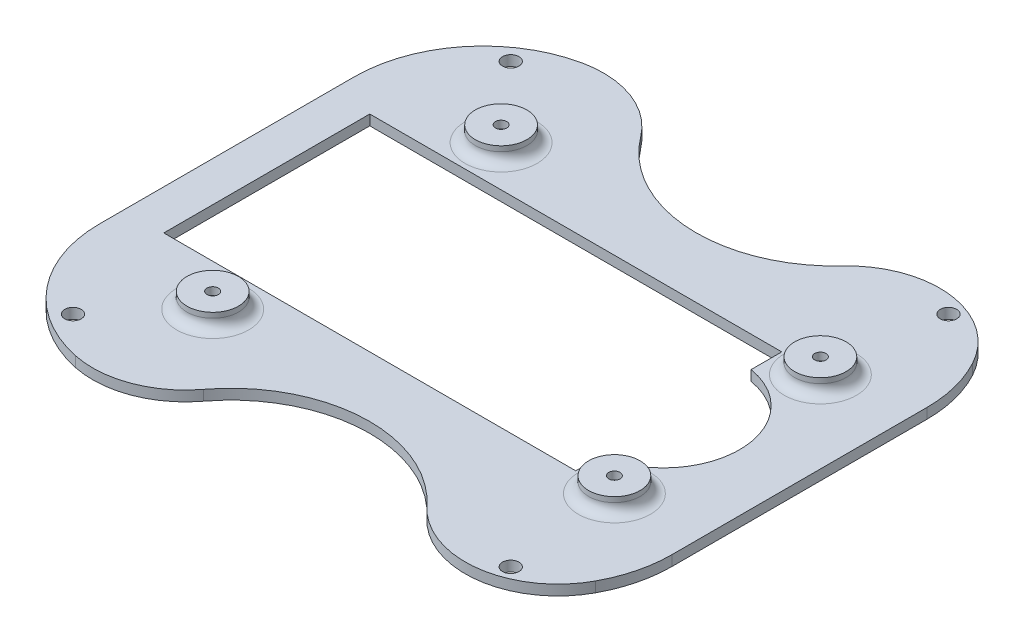
from build123d import *

# Parameters (mm, degrees)
SKETCH1_W               = 111.193579624
SKETCH1_H               = 99.509273796
SKETCH1_R               = 1.6
BOSS_EXTRUDE1_DEPTH     = 2
SKETCH2_R               = 5
BOSS_EXTRUDE2_DEPTH     = 3
CUT_EXTRUDE2_DEPTH      = 75.776513226
CUT_EXTRUDE2_DEPTH_BACK = 75.776513226
SKETCH3_R               = 1.1
CUT_EXTRUDE3_DEPTH      = 75.776513226
CUT_EXTRUDE3_DEPTH_BACK = 3.5
SKETCH4_R               = 3.5
FILLET1_R               = 25
CUT_EXTRUDE4_DEPTH      = 75.669451118
CUT_EXTRUDE4_DEPTH_BACK = 75.669451118
SKETCH5_W               = 80
SKETCH5_H               = 40
CUT_EXTRUDE5_DEPTH      = 75.669451118
CUT_EXTRUDE5_DEPTH_BACK = 75.669451118
CUT_EXTRUDE6_DEPTH      = 75.669451118
CUT_EXTRUDE6_DEPTH_BACK = 75.669451118
FILLET3_R               = 2
FILLET4_R               = 18


with BuildPart() as part:
    # Sketch1 → Boss-Extrude1 (new body)
    with BuildSketch(Plane(origin=(0, 0, 0), x_dir=(1, 0, 0), z_dir=(0, 1, 0))):
        Rectangle(SKETCH1_W, SKETCH1_H)
        with Locations(Location((-43.005863497, 42.538435101, 0), (0, 0, 270))):
            Circle(SKETCH1_R, mode=Mode.SUBTRACT)
        with Locations(Location((41.994136503, 42.538435101, 0), (0, 0, 270))):
            Circle(SKETCH1_R, mode=Mode.SUBTRACT)
        with Locations(Location((41.994136503, -42.461564899, 0), (0, 0, 270))):
            Circle(SKETCH1_R, mode=Mode.SUBTRACT)
        with Locations(Location((-43.005863497, -42.461564899, 0), (0, 0, 270))):
            Circle(SKETCH1_R, mode=Mode.SUBTRACT)
    extrude(amount=BOSS_EXTRUDE1_DEPTH)

    # Sketch2 → Boss-Extrude2 (add)
    with BuildSketch(Plane(origin=(0, 2, 0), x_dir=(1, 0, 0), z_dir=(0, 1, 0))):
        with Locations(Location((-30.275730538, 27.936106549, 0), (0, 0, 270))):
            Circle(SKETCH2_R)
        with Locations(Location((39.724269462, 19.936106549, 0), (0, 0, 270))):
            Circle(SKETCH2_R)
        with Locations(Location((39.724269462, -20.063893451, 0), (0, 0, 270))):
            Circle(SKETCH2_R)
        with Locations(Location((-30.275730538, -28.063893451, 0), (0, 0, 270))):
            Circle(SKETCH2_R)
    extrude(amount=BOSS_EXTRUDE2_DEPTH)

    # Sketch3 → Cut-Extrude2 (cut, two sides: drawn at the far end of the back side and taken through both)
    with BuildSketch(Plane(origin=(0, 5, 0), x_dir=(1, 0, 0), z_dir=(0, 1, 0)).offset(-CUT_EXTRUDE2_DEPTH_BACK)):
        with Locations(Location((-30.275730538, 27.936106549, 0), (0, 0, 270))):
            Circle(SKETCH3_R)
        with Locations(Location((39.724269462, 19.936106549, 0), (0, 0, 270))):
            Circle(SKETCH3_R)
        with Locations(Location((39.724269462, -20.063893451, 0), (0, 0, 270))):
            Circle(SKETCH3_R)
        with Locations(Location((-30.275730538, -28.063893451, 0), (0, 0, 270))):
            Circle(SKETCH3_R)
    extrude(amount=CUT_EXTRUDE2_DEPTH + CUT_EXTRUDE2_DEPTH_BACK, mode=Mode.SUBTRACT)

    # Sketch4 → Cut-Extrude3 (cut, two sides: drawn at the far end of the back side and taken through both)
    with BuildSketch(Plane.XZ.offset(-CUT_EXTRUDE3_DEPTH_BACK)):
        with Locations(Location((-30.275730538, 28.063893451, 0), (0, 0, 90))):
            Circle(SKETCH4_R)
        with Locations(Location((39.724269462, 20.063893451, 0), (0, 0, 90))):
            Circle(SKETCH4_R)
        with Locations(Location((39.724269462, -19.936106549, 0), (0, 0, 90))):
            Circle(SKETCH4_R)
        with Locations(Location((-30.275730538, -27.936106549, 0), (0, 0, 90))):
            Circle(SKETCH4_R)
    extrude(amount=CUT_EXTRUDE3_DEPTH + CUT_EXTRUDE3_DEPTH_BACK, mode=Mode.SUBTRACT)

    # Fillet1
    fillet1_edges = [part.edges().sort_by_distance(p)[0] for p in [
        (-55.596789812, 1, -49.754636898),
        (55.596789812, 1, -49.754636898),
        (55.596789812, 1, 49.754636898),
        (-55.596789812, 1, 49.754636898),
    ]]
    fillet(fillet1_edges, radius=FILLET1_R)

    # Sketch5 → Cut-Extrude4 (cut, two sides: drawn at the far end of the back side and taken through both)
    with BuildSketch(Plane(origin=(0, 2, 0), x_dir=(1, 0, 0), z_dir=(0, 1, 0)).offset(-CUT_EXTRUDE4_DEPTH_BACK)):
        with Locations((-7.838338825, 0)):
            Rectangle(SKETCH5_W, SKETCH5_H)
    extrude(amount=CUT_EXTRUDE4_DEPTH + CUT_EXTRUDE4_DEPTH_BACK, mode=Mode.SUBTRACT)

    # Sketch6 → Cut-Extrude5 (cut, two sides: drawn at the far end of the back side and taken through both)
    with BuildSketch(Plane(origin=(0, 2, 0), x_dir=(1, 0, 0), z_dir=(0, 1, 0)).offset(-CUT_EXTRUDE5_DEPTH_BACK)):
        with BuildLine():
            Line((-21.585028243, -49.754636898), (29.257650702, -49.754636898))
            ThreePointArc((29.257650702, -49.754636898), (3.836311229, -31.705915293), (-21.585028243, -49.754636898))
        make_face()
        with BuildLine():
            Line((-21.585028243, 49.754636898), (29.257650702, 49.754636898))
            ThreePointArc((29.257650702, 49.754636898), (3.836311229, 31.705915293), (-21.585028243, 49.754636898))
        make_face()
    extrude(amount=CUT_EXTRUDE5_DEPTH + CUT_EXTRUDE5_DEPTH_BACK, mode=Mode.SUBTRACT)

    # Sketch7 → Cut-Extrude6 (cut, two sides: drawn at the far end of the back side and taken through both)
    with BuildSketch(Plane(origin=(0, 2, 0), x_dir=(1, 0, 0), z_dir=(0, 1, 0)).offset(-CUT_EXTRUDE6_DEPTH_BACK)):
        with BuildLine():
            Line((32.161661175, 14.041836801), (32.161661175, -15.135059457))
            ThreePointArc((32.161661175, -15.135059457), (44.520164004, -0.546611328), (32.161661175, 14.041836801))
        make_face()
    extrude(amount=CUT_EXTRUDE6_DEPTH + CUT_EXTRUDE6_DEPTH_BACK, mode=Mode.SUBTRACT)

    # Fillet3
    fillet3_edges = [part.edges().sort_by_distance(p)[0] for p in [
        (-30.275730538, 2, -32.936106549),
        (39.724269462, 2, -24.936106549),
        (39.724269462, 2, 15.063893451),
        (-30.275730538, 2, 23.063893451),
    ]]
    fillet(fillet3_edges, radius=FILLET3_R)

    # Fillet4
    fillet4_edges = [part.edges().sort_by_distance(p)[0] for p in [
        (-21.585028243, 1, 49.754636898),
        (29.257650702, 1, 49.754636898),
        (29.257650702, 1, -49.754636898),
        (-21.585028243, 1, -49.754636898),
    ]]
    fillet(fillet4_edges, radius=FILLET4_R)


solid = part.part
